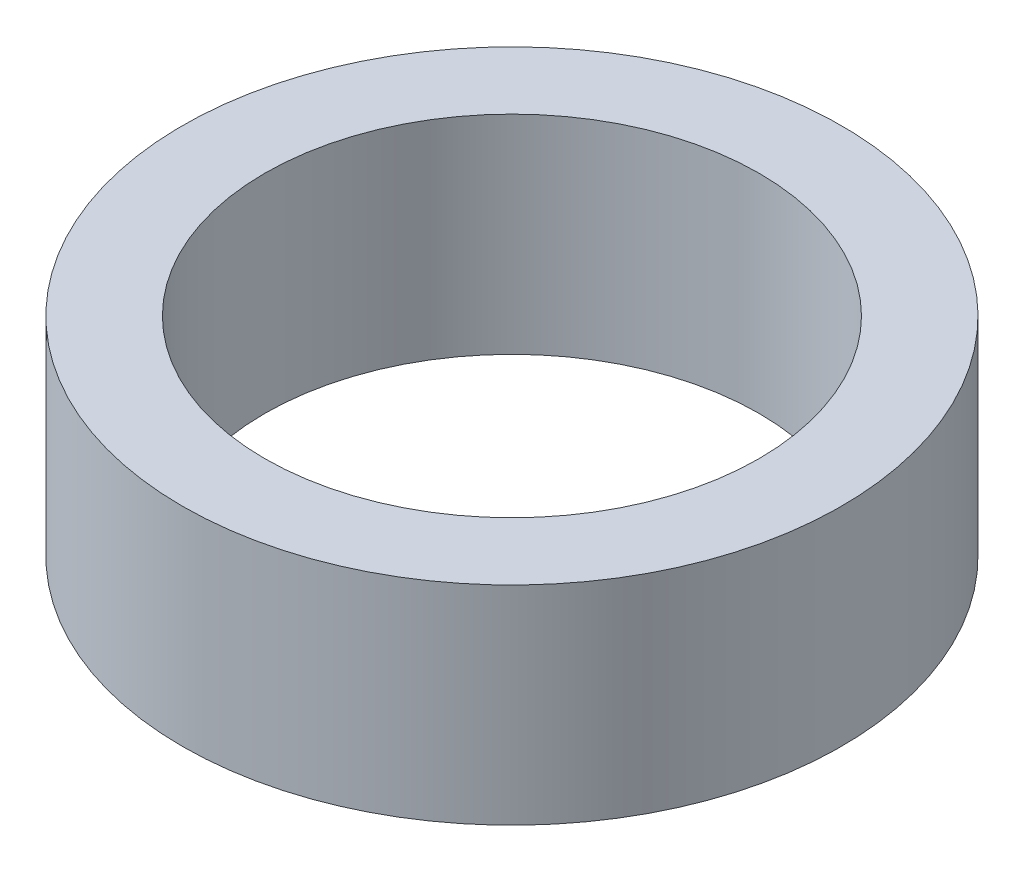
from build123d import *

# Parameters (mm, degrees)
SKETCH1_R           = 10.16
SKETCH1_R_2         = 7.62
BOSS_EXTRUDE1_DEPTH = 6.4135


with BuildPart() as part:
    # Sketch1 → Boss-Extrude1 (new body)
    with BuildSketch(Plane(origin=(0, 0, 0), x_dir=(1, 0, 0), z_dir=(0, 1, 0))):
        with Locations(Location((0, 0, 0), (0, 0, 270))):
            Circle(SKETCH1_R)
        with Locations(Location((0, 0, 0), (0, 0, 270))):
            Circle(SKETCH1_R_2, mode=Mode.SUBTRACT)
    extrude(amount=BOSS_EXTRUDE1_DEPTH)


solid = part.part
